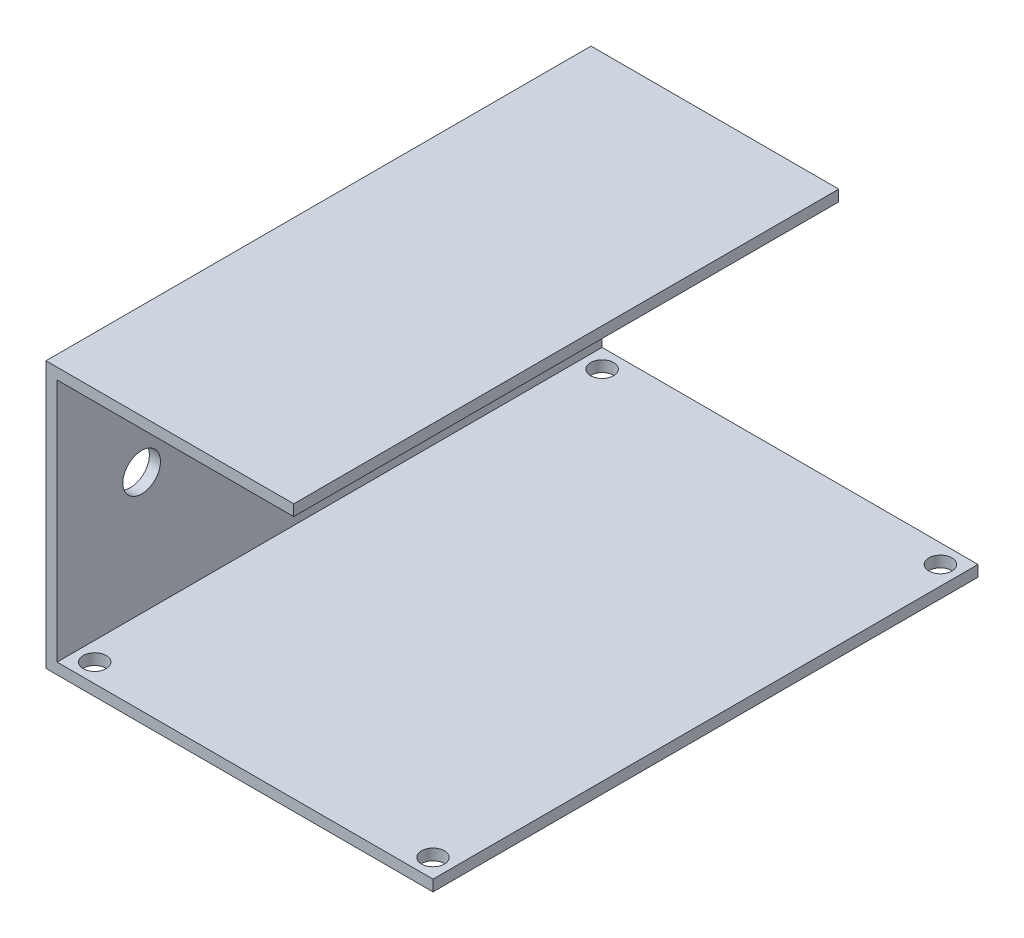
from build123d import *

# Parameters (mm, degrees)
SKETCH_1_W          = 50.8
SKETCH_1_H          = 73.66
SKETCH_1_R          = 1.55
EXTRUDE_1_DEPTH     = 1.5
SKETCH_2_W          = 73.66
SKETCH_2_H          = 1.5
EXTRUDE_2_DEPTH     = 1.5
SKETCH_3_W          = 1.5
SKETCH_3_H          = 73.66
EXTRUDE_3_DEPTH     = 33.02
SKETCH_4_R          = 5.334
SKETCH_4_R_2        = 2.54
CUT_EXTRUDE_1_DEPTH = 33.02
SKETCH_6_W          = 1.5
SKETCH_6_H          = 73.66
EXTRUDE_4_DEPTH     = 1.5
SKETCH_7_W          = 73.66
SKETCH_7_H          = 1.5
EXTRUDE_5_DEPTH     = 31.98


with BuildPart() as part:
    # 草图1 → 凸台-拉伸1 (new body)
    with BuildSketch(Plane(origin=(0, 0, 0), x_dir=(1, 0, 0), z_dir=(0, 1, 0))):
        Rectangle(SKETCH_1_W, SKETCH_1_H)
        with Locations(Location((-22.86, 34.29, 0), (0, 0, 270))):
            Circle(SKETCH_1_R, mode=Mode.SUBTRACT)
        with Locations(Location((22.86, 34.29, 0), (0, 0, 270))):
            Circle(SKETCH_1_R, mode=Mode.SUBTRACT)
        with Locations(Location((22.86, -34.29, 0), (0, 0, 270))):
            Circle(SKETCH_1_R, mode=Mode.SUBTRACT)
        with Locations(Location((-22.86, -34.29, 0), (0, 0, 270))):
            Circle(SKETCH_1_R, mode=Mode.SUBTRACT)
    extrude(amount=EXTRUDE_1_DEPTH)

    # 草图2 → 凸台-拉伸2 (add)
    with BuildSketch(Plane.ZY.offset(25.4)):
        with Locations((0, 0.75)):
            Rectangle(SKETCH_2_W, SKETCH_2_H)
    extrude(amount=EXTRUDE_2_DEPTH)

    # 草图3 → 凸台-拉伸3 (add)
    with BuildSketch(Plane(origin=(0, 1.5, 0), x_dir=(1, 0, 0), z_dir=(0, 1, 0))):
        with Locations((-26.15, 0)):
            Rectangle(SKETCH_3_W, SKETCH_3_H)
    extrude(amount=EXTRUDE_3_DEPTH)

    # 草图4 → 切除-拉伸1 (cut)
    with BuildSketch(Plane(origin=(-25.4, 0, 0), x_dir=(0, 0, -1), z_dir=(1, 0, 0))):
        with Locations((0, 18.01)):
            Circle(SKETCH_4_R)
        with Locations((12.7, 18.01)):
            Circle(SKETCH_4_R_2)
        with Locations((25.4, 18.01)):
            Circle(SKETCH_4_R_2)
        with Locations((-12.7, 18.01)):
            Circle(SKETCH_4_R_2)
        with Locations((-25.4, 18.01)):
            Circle(SKETCH_4_R_2)
    extrude(amount=-CUT_EXTRUDE_1_DEPTH, mode=Mode.SUBTRACT)

    # 草图6 → 凸台-拉伸4 (add)
    with BuildSketch(Plane(origin=(0, 34.52, 0), x_dir=(1, 0, 0), z_dir=(0, 1, 0))):
        with Locations((-26.15, 0)):
            Rectangle(SKETCH_6_W, SKETCH_6_H)
    extrude(amount=EXTRUDE_4_DEPTH)

    # 草图7 → 凸台-拉伸5 (add)
    with BuildSketch(Plane(origin=(-25.4, 0, 0), x_dir=(0, 0, -1), z_dir=(1, 0, 0))):
        with Locations((0, 35.27)):
            Rectangle(SKETCH_7_W, SKETCH_7_H)
    extrude(amount=EXTRUDE_5_DEPTH)


solid = part.part
